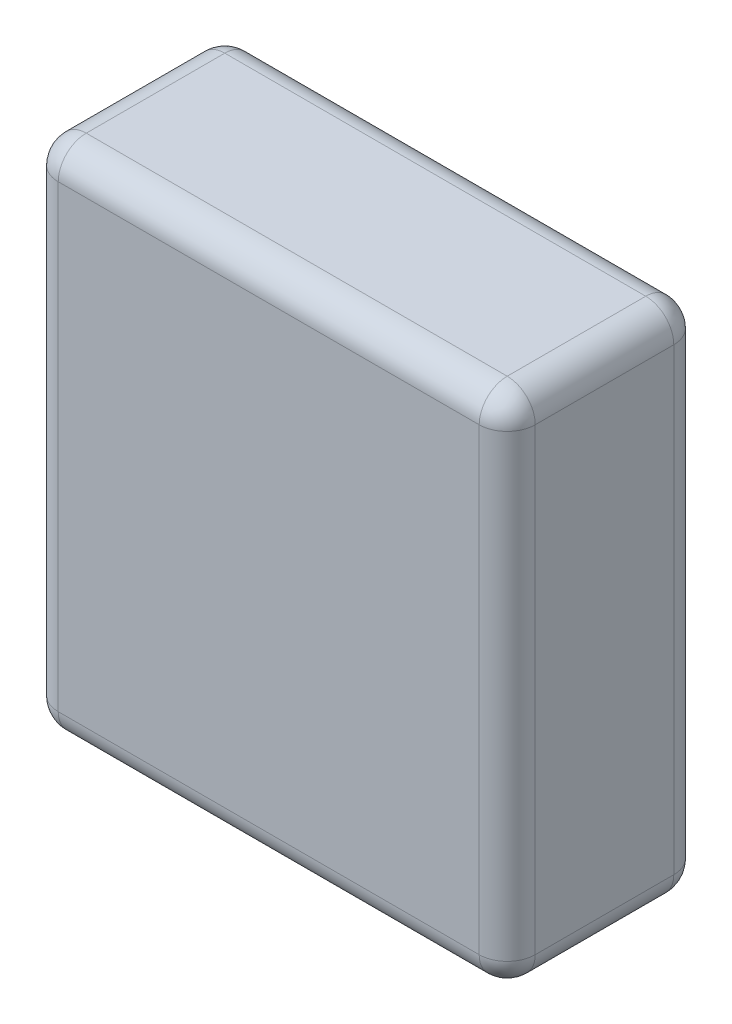
from build123d import *

# Parameters (mm, degrees)
SKETCH1_W           = 51.054
SKETCH1_H           = 55.118
BOSS_EXTRUDE1_DEPTH = 20.828
FILLET1_R           = 3


with BuildPart() as part:
    # Sketch1 → Boss-Extrude1 (new body)
    with BuildSketch(Plane.XY):
        with Locations((25.527, 27.559)):
            Rectangle(SKETCH1_W, SKETCH1_H)
    extrude(amount=BOSS_EXTRUDE1_DEPTH)

    # Fillet1
    fillet1_edges = [part.edges().sort_by_distance(p)[0] for p in [
        (51.054, 27.559, 20.828),
        (25.527, 55.118, 20.828),
        (0, 27.559, 20.828),
        (25.527, 55.118, 0),
        (51.054, 27.559, 0),
        (25.527, 0, 0),
        (0, 27.559, 0),
        (25.527, 0, 20.828),
        (0, 55.118, 10.414),
        (51.054, 55.118, 10.414),
        (51.054, 0, 10.414),
        (0, 0, 10.414),
    ]]
    fillet(fillet1_edges, radius=FILLET1_R)


solid = part.part
